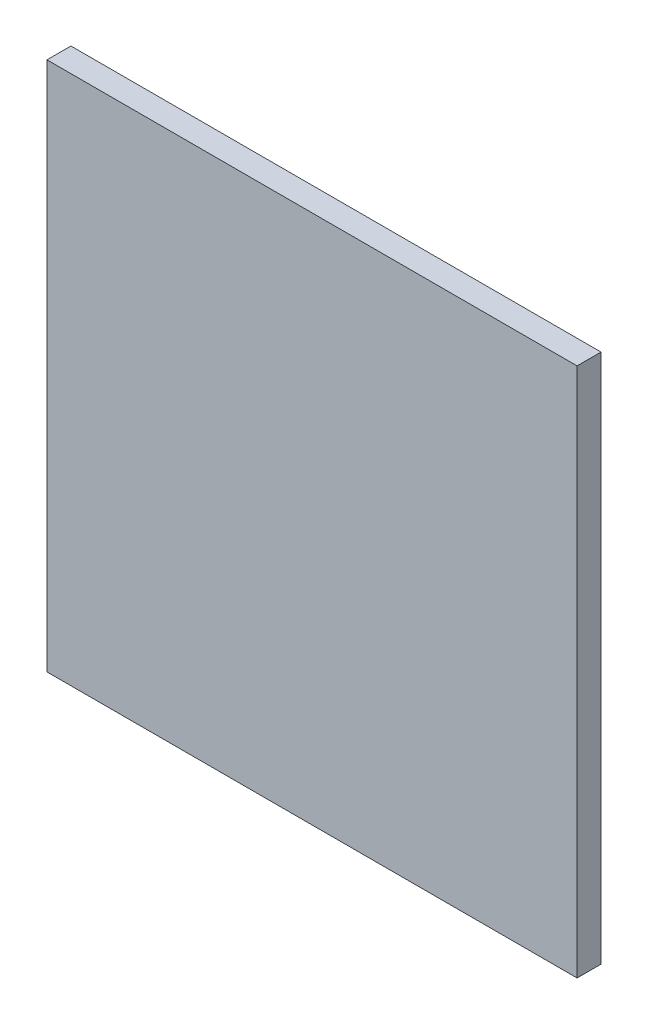
from build123d import *

# Parameters (mm, degrees)
SKETCH_1_R         = 13
EXTRUDE_1189_DEPTH = 14
SKETCH_3_W         = 310
SKETCH_3_H         = 310
EXTRUDE_1_DEPTH    = 14


with BuildPart() as part:
    # 草图1 → Extrude 1189 (new body)
    with BuildSketch(Plane.XY):
        Polygon((135, 155), (155, 135), (155, -155), (-135, -155), (-155, -135), (-155, 155), align=None)
        with Locations((-113.13708499, -113.13708499)):
            Circle(SKETCH_1_R, mode=Mode.SUBTRACT)
        with Locations((-78.524110604, -61.919012055)):
            Circle(SKETCH_1_R, mode=Mode.SUBTRACT)
        with Locations((78.524110604, 61.919012055)):
            Circle(SKETCH_1_R, mode=Mode.SUBTRACT)
        with Locations((113.13708499, 113.13708499)):
            Circle(SKETCH_1_R, mode=Mode.SUBTRACT)
        with Locations((-70.710678119, 70.710678119)):
            Circle(SKETCH_1_R, mode=Mode.SUBTRACT)
        with Locations((-113.13708499, 113.13708499)):
            Circle(SKETCH_1_R, mode=Mode.SUBTRACT)
        with Locations(Location((70.710678119, -70.710678119, 0), (0, 0, 180))):
            Circle(SKETCH_1_R, mode=Mode.SUBTRACT)
        with Locations(Location((113.13708499, -113.13708499, 0), (0, 0, 180))):
            Circle(SKETCH_1_R, mode=Mode.SUBTRACT)
        Circle(SKETCH_1_R, mode=Mode.SUBTRACT)
    extrude(amount=EXTRUDE_1189_DEPTH)

    # 草图3 → 凸台-拉伸1 (add)
    with BuildSketch(Plane.XY.offset(14)):
        Rectangle(SKETCH_3_W, SKETCH_3_H)
    extrude(amount=-EXTRUDE_1_DEPTH)


solid = part.part
